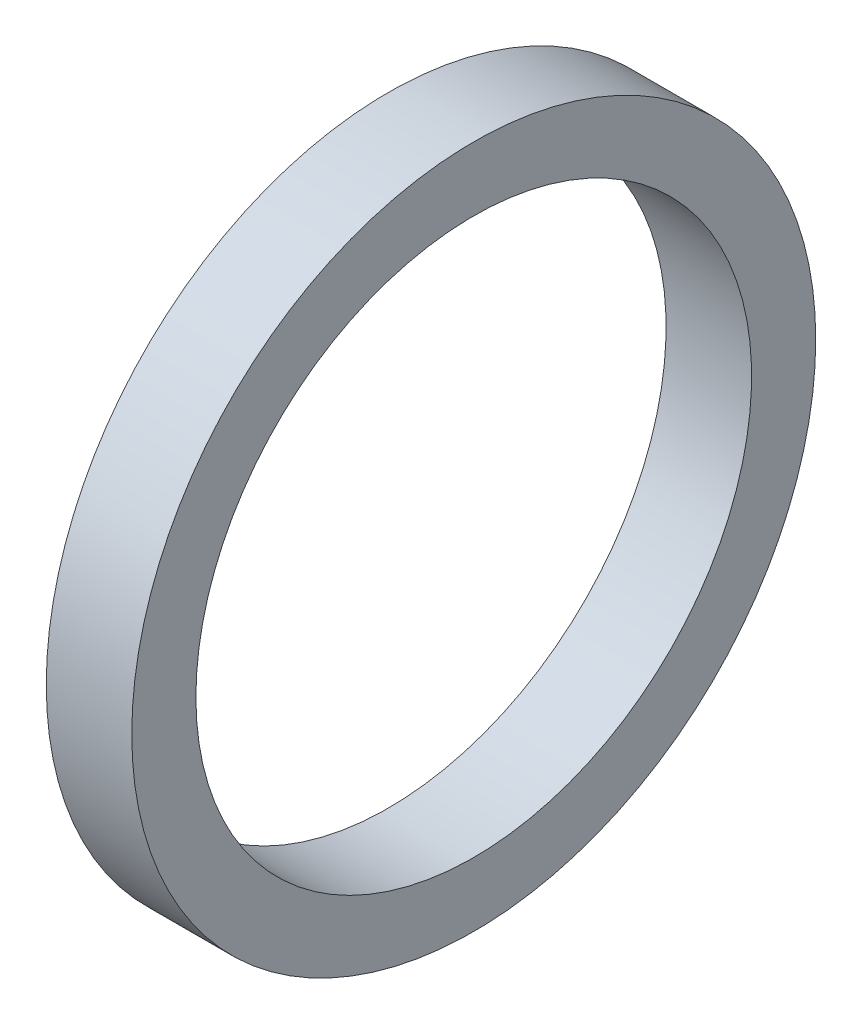
from build123d import *

# Parameters (mm, degrees)
SKETCH_1_W = 10
SKETCH_1_H = 7.5


with BuildPart() as part:
    # 草图1 → 旋转1 (revolve)
    with BuildSketch(Plane.XY, mode=Mode.PRIVATE) as revolve_1_sk:
        with Locations((5, 36.25)):
            Rectangle(SKETCH_1_W, SKETCH_1_H)
    revolve(revolve_1_sk.sketch.rotate(Axis((-59.659258107, 0, 0), (1, 0, 0)), 90), axis=Axis((-59.659258107, 0, 0), (1, 0, 0)))


solid = part.part
